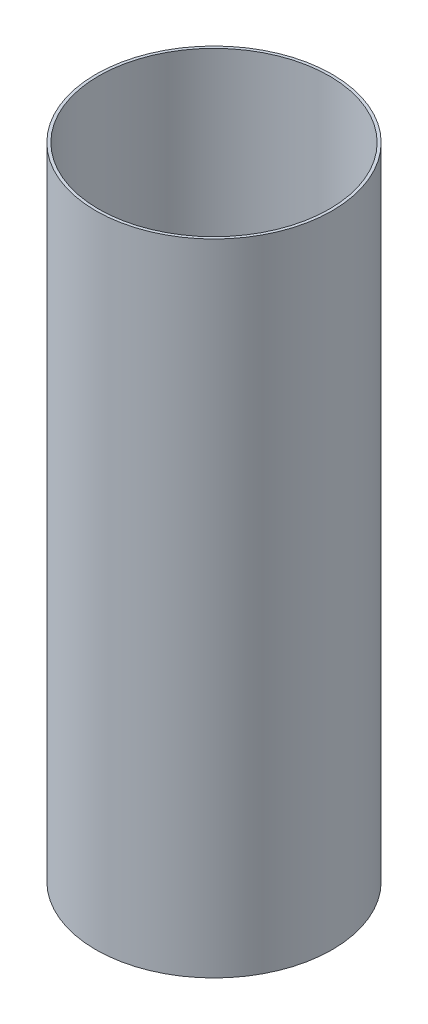
from build123d import *

# Parameters (mm, degrees)
LOWER_SIDE_R            = 33.25
LOWER_SIDE_R_2          = 32.45
MAIN_BODY_DEPTH         = 180
SKETCH_1_5_R            = 33.25
BOTTOM_DEPTH            = 1.2
BOTTOM_CUT_DEPTH        = 1.2
SLOPE_1_REACH           = 188.041
SLOPE_1_END_RADIUS      = 32.45
SLOPE_2_REACH           = 188.041
SLOPE_2_END_RADIUS      = 32.45
STOPPER_DEPTH           = 3
STOPPER_DRAFT           = -1
STOPPER_PROFILE_2_DEPTH = 3
STOPPER_PROFILE_2_DRAFT = -1


with BuildPart() as part:
    # lower_side → Main_body (new body)
    with BuildSketch(Plane(origin=(0, 0, 0), x_dir=(1, 0, 0), z_dir=(0, 1, 0))):
        Circle(LOWER_SIDE_R)
        Circle(LOWER_SIDE_R_2, mode=Mode.SUBTRACT)
    extrude(amount=MAIN_BODY_DEPTH)

    # Эскиз1<5> → Bottom (add)
    with BuildSketch(Plane(origin=(0, 0, 0), x_dir=(1, 0, 0), z_dir=(0, 1, 0))):
        Circle(SKETCH_1_5_R)
    extrude(amount=BOTTOM_DEPTH)

    # bottom_cut_draft → Bottom_cut (cut)
    with BuildSketch(Plane.XZ):
        with BuildLine():
            Line((6, 31.5), (-6, 31.5))
            Line((-6, 31.5), (-6, 12.093386622))
            ThreePointArc((-6, 12.093386622), (-13.5, 0), (-6, -12.093386622))
            Line((-6, -12.093386622), (-6, -31.5))
            Line((-6, -31.5), (6, -31.5))
            Line((6, -31.5), (6, -12.093386622))
            ThreePointArc((6, -12.093386622), (13.5, 0), (6, 12.093386622))
            Line((6, 12.093386622), (6, 31.5))
        make_face()
    extrude(amount=-BOTTOM_CUT_DEPTH, mode=Mode.SUBTRACT)

    # Slope_1: up to this cylinder (the profile starts inside it)
    slope_1_end = Plane(origin=(0, 0.933333, 0), z_dir=(0, -1, 0)) * Cylinder(SLOPE_1_END_RADIUS, 441.982, mode=Mode.PRIVATE)
    # slope_draft → Slope_1 (cut, up to the surface)
    with BuildSketch(Plane.XY, mode=Mode.PRIVATE) as slope_1_sk1:
        Polygon((13.5, 1.2), (6, 1.2), (6, 0.4), align=None)
    slope_1_tool1 = extrude(slope_1_sk1.sketch, amount=SLOPE_1_REACH, mode=Mode.PRIVATE) & slope_1_end
    add(slope_1_tool1.solids().sort_by_distance((8.5, 0.933333, 0))[0], mode=Mode.SUBTRACT)

    # Slope_2: up to this cylinder (the profile starts inside it)
    slope_2_end = Plane(origin=(0, 0.933333, 0), z_dir=(0, -1, 0)) * Cylinder(SLOPE_2_END_RADIUS, 441.982, mode=Mode.PRIVATE)
    # Эскиз6<3> → Slope_2 (cut, up to the surface)
    with BuildSketch(Plane.XY, mode=Mode.PRIVATE) as slope_2_sk1:
        Polygon((-13.5, 1.2), (-6, 0.4), (-6, 1.2), align=None)
    slope_2_tool1 = extrude(slope_2_sk1.sketch, amount=-SLOPE_2_REACH, mode=Mode.PRIVATE) & slope_2_end
    add(slope_2_tool1.solids().sort_by_distance((-8.5, 0.933333, 0))[0], mode=Mode.SUBTRACT)


with BuildPart() as stopper_tool:
    # Эскиз5<3> → Stopper (with draft: the straight prism first)
    with BuildSketch(Plane.XZ):
        with BuildLine():
            ThreePointArc((-12.093386622, 6), (-11.527291344, 7.02648947), (-10.874281585, 8))
            Line((-10.874281585, 8), (-32.273247435, 8))
            ThreePointArc((-32.273247435, 8), (-32.504093238, 7.003315128), (-32.704166401, 6))
            Line((-32.704166401, 6), (-12.093386622, 6))
        make_face()
    extrude(amount=-STOPPER_DEPTH)
    # Stopper: the draft: its side faces are tilted about the plane it starts from
    stopper_sides = [stopper_tool.faces().sort_by_distance(p)[0] for p in [
        (-32.504093238, 1.5, 7.003315128),
        (-22.398776512, 1.5, 6),
        (-11.527291344, 1.5, 7.02648947),
        (-21.57376451, 1.5, 8),
    ]]
    draft(stopper_sides, Plane.XZ, STOPPER_DRAFT)


with BuildPart() as part_1:
    add(part.part)

    # Stopper: add stopper_tool
    add(stopper_tool.part)


with BuildPart() as stopper_profile_2_tool:
    # Эскиз5<3> → Stopper profile 2 (with draft: the straight prism first)
    with BuildSketch(Plane.XZ):
        with BuildLine():
            ThreePointArc((11.972436163, -6.237849977), (11.457286814, -7.140068547), (10.874281585, -8))
            Line((10.874281585, -8), (32.273247435, -8))
            ThreePointArc((32.273247435, -8), (32.478394099, -7.121545951), (32.659634531, -6.237849977))
            Line((32.659634531, -6.237849977), (11.972436163, -6.237849977))
        make_face()
    extrude(amount=-STOPPER_PROFILE_2_DEPTH)
    # Stopper profile 2: the draft: its side faces are tilted about the plane it starts from
    stopper_profile_2_sides = [stopper_profile_2_tool.faces().sort_by_distance(p)[0] for p in [
        (11.457286814, 1.5, -7.140068547),
        (21.57376451, 1.5, -8),
        (32.478394099, 1.5, -7.121545951),
        (22.316035347, 1.5, -6.237849977),
    ]]
    draft(stopper_profile_2_sides, Plane.XZ, STOPPER_PROFILE_2_DRAFT)


with BuildPart() as part_2:
    add(part_1.part)

    # Stopper profile 2: add stopper_profile_2_tool
    add(stopper_profile_2_tool.part)


solid = part_2.part
